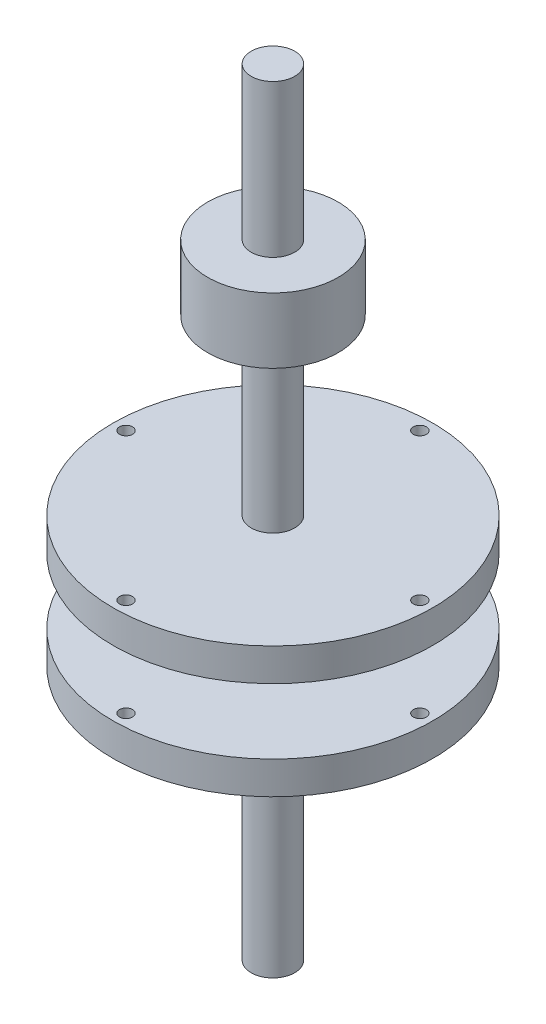
from build123d import *

# Parameters (mm, degrees)
SKETCH1_W          = 10
SKETCH1_H          = 30
SKETCH1_W_2        = 20
SKETCH1_H_2        = 70
SKETCH2_R          = 3
CUT_EXTRUDE1_DEPTH = 80


with BuildPart() as part:
    # Sketch1 → Revolve3 (revolve)
    with BuildSketch(Plane.XY, mode=Mode.PRIVATE) as revolve3_sk:
        Polygon((0, 78.35475), (0, -178.35475), (10, -178.35475), (10, -61.35475), (73.5, -61.35475), (73.5, -46.35475), (10, -46.35475), (10, -16.35475), (73.5, -16.35475), (73.5, -1.35475), (10, -1.35475), (10, 78.35475), align=None)
        with Locations((5, 93.35475)):
            Rectangle(SKETCH1_W, SKETCH1_H)
        with Locations((20, 93.35475)):
            Rectangle(SKETCH1_W_2, SKETCH1_H)
        with Locations((5, 143.35475)):
            Rectangle(SKETCH1_W, SKETCH1_H_2)
    revolve(revolve3_sk.sketch.rotate(Axis((0, 223.956756344, 0), (0, -1, 0)), 180), axis=Axis((0, 223.956756344, 0), (0, -1, 0)))

    # Sketch2 → Cut-Extrude1 (cut)
    with BuildSketch(Plane.XZ.offset(61.35475)):
        with Locations((67.5, 0)):
            Circle(SKETCH2_R)
        with Locations((-67.5, 0)):
            Circle(SKETCH2_R)
        with Locations((0, 67.5)):
            Circle(SKETCH2_R)
        with Locations((0, -67.5)):
            Circle(SKETCH2_R)
    extrude(amount=-CUT_EXTRUDE1_DEPTH, mode=Mode.SUBTRACT)


solid = part.part
